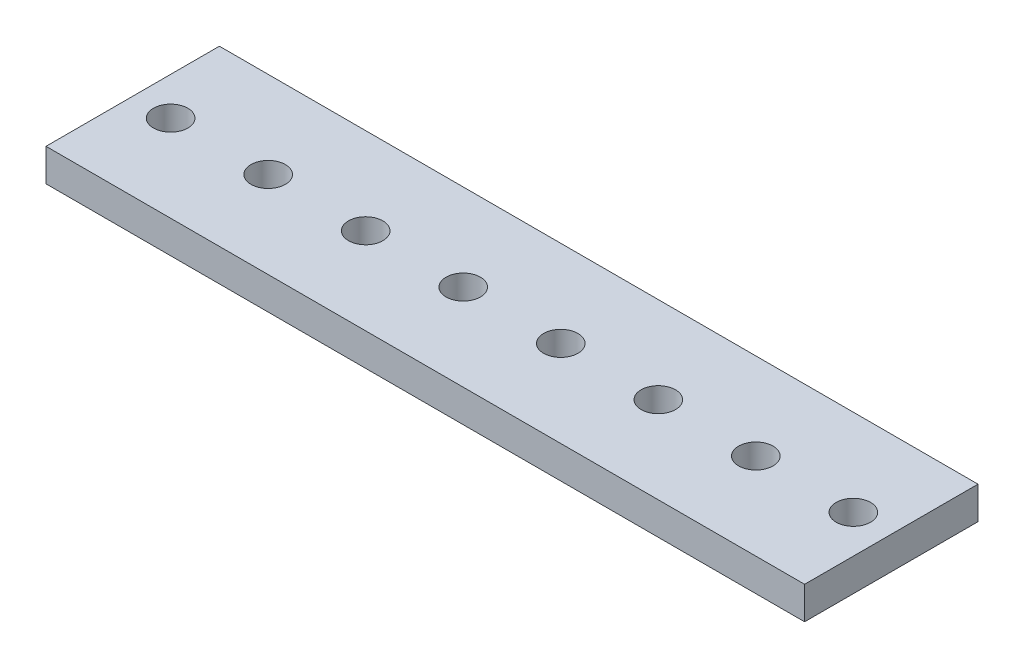
from build123d import *

# Parameters (mm, degrees)
SKETCH1_W           = 70
SKETCH1_H           = 16
SKETCH1_R           = 1.5875
BOSS_EXTRUDE1_DEPTH = 3


with BuildPart() as part:
    # Sketch1 → Boss-Extrude1 (new body)
    with BuildSketch(Plane(origin=(0, 0, 0), x_dir=(1, 0, 0), z_dir=(0, 1, 0))):
        Rectangle(SKETCH1_W, SKETCH1_H)
        with Locations(Location((-4.5, 0, 0), (0, 0, 270))):
            Circle(SKETCH1_R, mode=Mode.SUBTRACT)
        with Locations(Location((4.5, 0, 0), (0, 0, 270))):
            Circle(SKETCH1_R, mode=Mode.SUBTRACT)
        with Locations(Location((13.5, 0, 0), (0, 0, 270))):
            Circle(SKETCH1_R, mode=Mode.SUBTRACT)
        with Locations(Location((22.5, 0, 0), (0, 0, 270))):
            Circle(SKETCH1_R, mode=Mode.SUBTRACT)
        with Locations(Location((31.5, 0, 0), (0, 0, 270))):
            Circle(SKETCH1_R, mode=Mode.SUBTRACT)
        with Locations(Location((-13.5, 0, 0), (0, 0, 270))):
            Circle(SKETCH1_R, mode=Mode.SUBTRACT)
        with Locations(Location((-22.5, 0, 0), (0, 0, 270))):
            Circle(SKETCH1_R, mode=Mode.SUBTRACT)
        with Locations(Location((-31.5, 0, 0), (0, 0, 270))):
            Circle(SKETCH1_R, mode=Mode.SUBTRACT)
    extrude(amount=BOSS_EXTRUDE1_DEPTH)


solid = part.part
